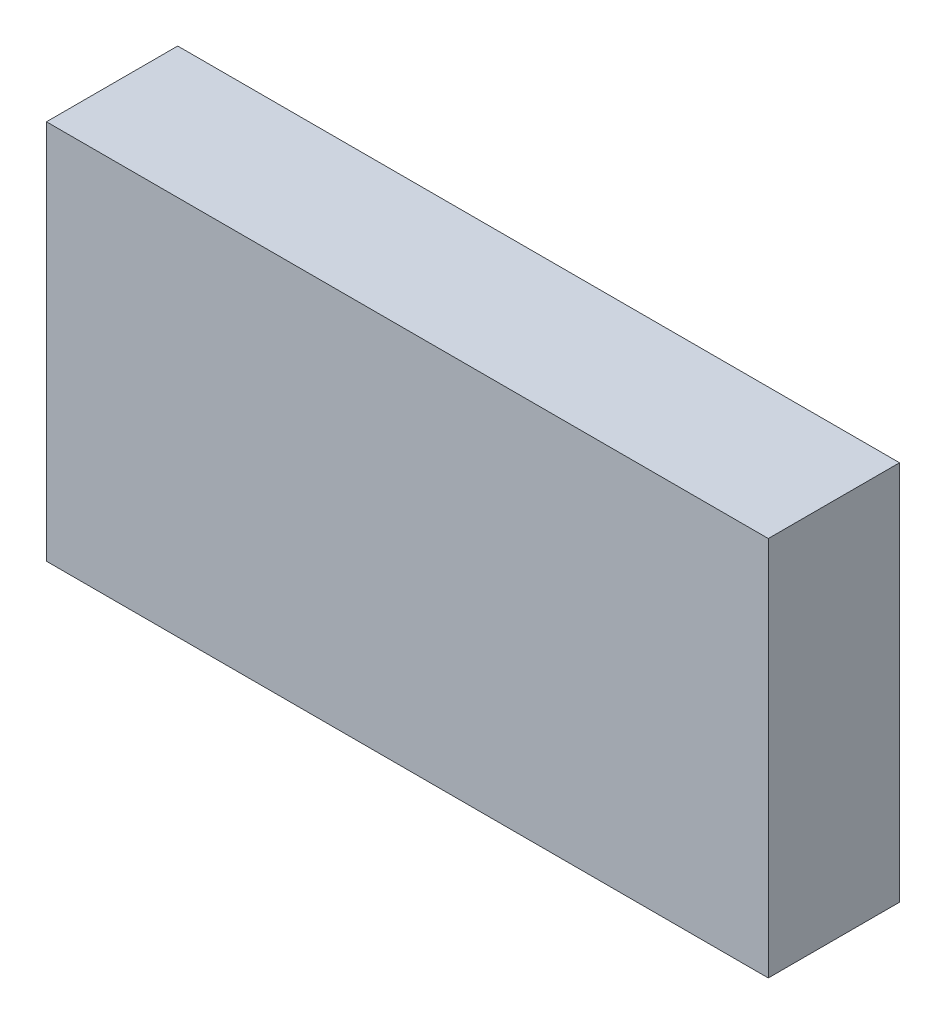
from build123d import *

# Parameters (mm, degrees)
ESQUISSE1_W        = 55
ESQUISSE1_H        = 29
BOSS_EXTRU_1_DEPTH = 10


with BuildPart() as part:
    # Esquisse1 → Boss.-Extru.1 (new body)
    with BuildSketch(Plane.XY):
        with Locations((27.5, 14.5)):
            Rectangle(ESQUISSE1_W, ESQUISSE1_H)
    extrude(amount=BOSS_EXTRU_1_DEPTH)


solid = part.part
